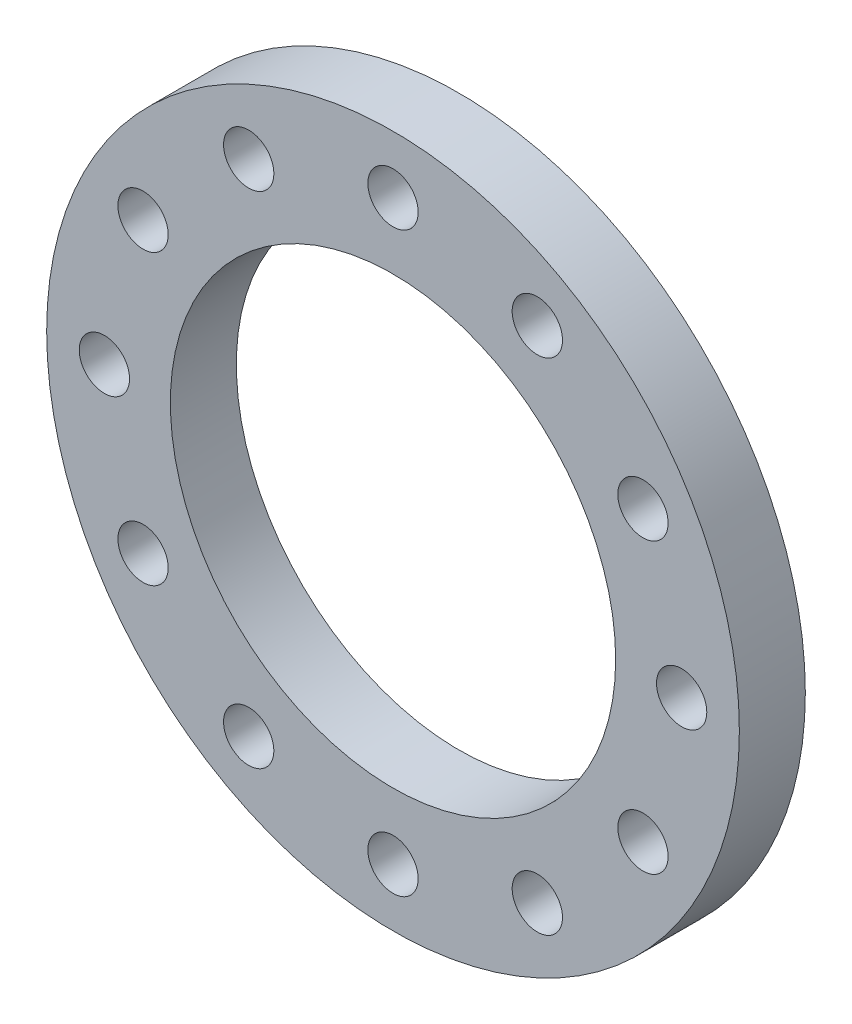
from build123d import *

# Parameters (mm, degrees)
SKETCH_1_R      = 21
SKETCH_1_R_2    = 13.5
SKETCH_1_R_3    = 1.525
EXTRUDE_1_DEPTH = 4


with BuildPart() as part:
    # 草图1 → 凸台-拉伸1 (new body)
    with BuildSketch(Plane.XY):
        Circle(SKETCH_1_R)
        Circle(SKETCH_1_R_2, mode=Mode.SUBTRACT)
        with Locations((0, 17.5)):
            Circle(SKETCH_1_R_3, mode=Mode.SUBTRACT)
        with Locations((17.5, 0)):
            Circle(SKETCH_1_R_3, mode=Mode.SUBTRACT)
        with Locations((0, -17.5)):
            Circle(SKETCH_1_R_3, mode=Mode.SUBTRACT)
        with Locations((-17.5, 0)):
            Circle(SKETCH_1_R_3, mode=Mode.SUBTRACT)
        with Locations((15.155444566, -8.75)):
            Circle(SKETCH_1_R_3, mode=Mode.SUBTRACT)
        with Locations((8.75, 15.155444566)):
            Circle(SKETCH_1_R_3, mode=Mode.SUBTRACT)
        with Locations((-15.155444566, 8.75)):
            Circle(SKETCH_1_R_3, mode=Mode.SUBTRACT)
        with Locations((-8.75, -15.155444566)):
            Circle(SKETCH_1_R_3, mode=Mode.SUBTRACT)
        with Locations((-15.155444566, -8.75)):
            Circle(SKETCH_1_R_3, mode=Mode.SUBTRACT)
        with Locations((8.75, -15.155444566)):
            Circle(SKETCH_1_R_3, mode=Mode.SUBTRACT)
        with Locations((15.155444566, 8.75)):
            Circle(SKETCH_1_R_3, mode=Mode.SUBTRACT)
        with Locations((-8.75, 15.155444566)):
            Circle(SKETCH_1_R_3, mode=Mode.SUBTRACT)
    extrude(amount=EXTRUDE_1_DEPTH)


solid = part.part
